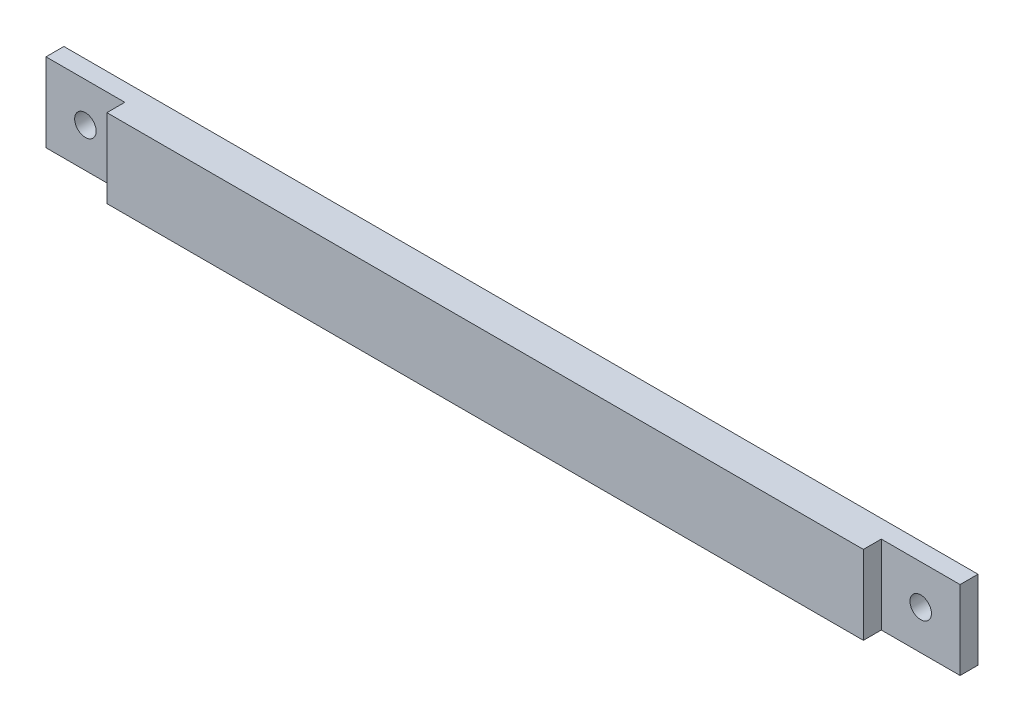
from build123d import *

# Parameters (mm, degrees)
ESQUISSE1_W             = 255.2
ESQUISSE1_H             = 22
ESQUISSE1_R             = 3
BOSS_EXTRU_1_DEPTH      = 10
ESQUISSE2_W             = 22
ESQUISSE2_H             = 22
ENL_V_MAT_EXTRU_1_DEPTH = 5


with BuildPart() as part:
    # Esquisse1 → Boss.-Extru.1 (new body)
    with BuildSketch(Plane.XY):
        with Locations((25.071580326, 34.85625)):
            Rectangle(ESQUISSE1_W, ESQUISSE1_H)
        with Locations((-91.528419674, 34.85625)):
            Circle(ESQUISSE1_R, mode=Mode.SUBTRACT)
        with Locations((141.671580326, 34.85625)):
            Circle(ESQUISSE1_R, mode=Mode.SUBTRACT)
    extrude(amount=BOSS_EXTRU_1_DEPTH)

    # Esquisse2 → Enlèv. mat.-Extru.1 (cut)
    with BuildSketch(Plane.XY.offset(10)):
        with Locations((-91.528419674, 34.85625)):
            Rectangle(ESQUISSE2_W, ESQUISSE2_H)
        with Locations((141.671580326, 34.85625)):
            Rectangle(ESQUISSE2_W, ESQUISSE2_H)
    extrude(amount=-ENL_V_MAT_EXTRU_1_DEPTH, mode=Mode.SUBTRACT)


solid = part.part
